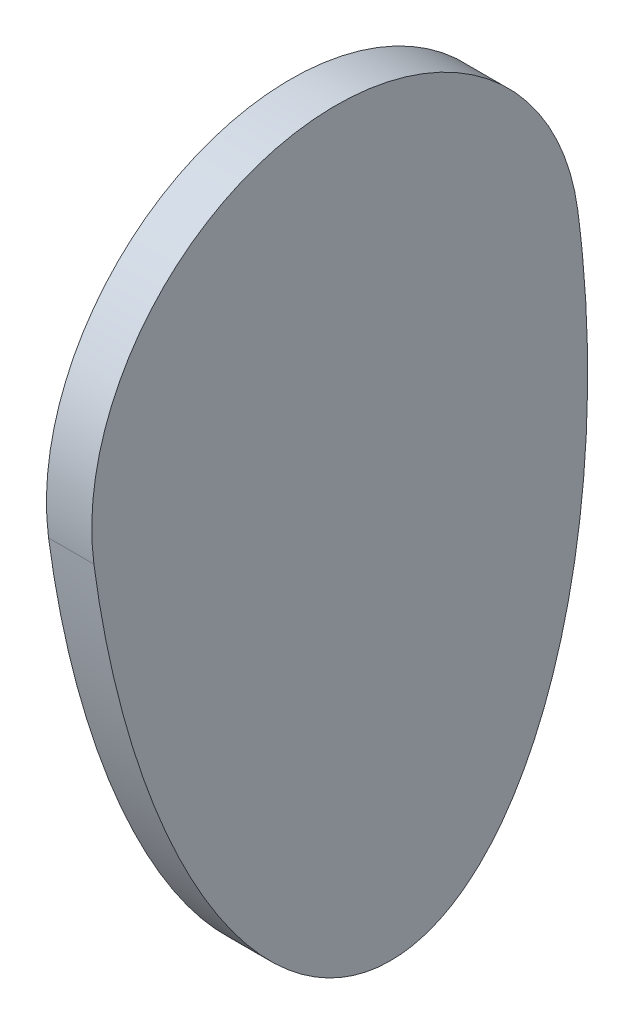
from build123d import *

# Parameters (mm, degrees)
RESSALTO_EXTRUS_O11_DEPTH = 13
ESBO_O44_R                = 20
RESSALTO_EXTRUS_O12_DEPTH = 10


with BuildPart() as part:
    # Esboço43 → Ressalto-extrusão11 (new body)
    with BuildSketch(Plane(origin=(0, 0, 0), x_dir=(0, 0, -1), z_dir=(1, 0, 0))):
        with BuildLine():
            ThreePointArc((69.385953048, 9.251460406), (-9.251460406, 69.385953048), (-69.385953048, -9.251460406))
            add(Edge.make_bspline(
                [(-69.385953048, -9.251460406), (-49.385953048, -159.251460406), (20, -150), (89.385953048, -140.748539594), (69.385953048, 9.251460406)],
                knots=[4.71238898, 4.71238898, 4.71238898, 6.283185307, 6.283185307, 7.853981634, 7.853981634, 7.853981634], degree=2, weights=[1, 0.707106781, 1, 0.707106781, 1]))
        make_face()
    extrude(amount=RESSALTO_EXTRUS_O11_DEPTH)

    # Esboço44 → Ressalto-extrusão12 (add)
    with BuildSketch(Plane(origin=(0, 0, 0), x_dir=(0, 0, -1), z_dir=(1, 0, 0))):
        with Locations((-5, 28.000002978)):
            Circle(ESBO_O44_R)
    extrude(amount=-RESSALTO_EXTRUS_O12_DEPTH)


solid = part.part
